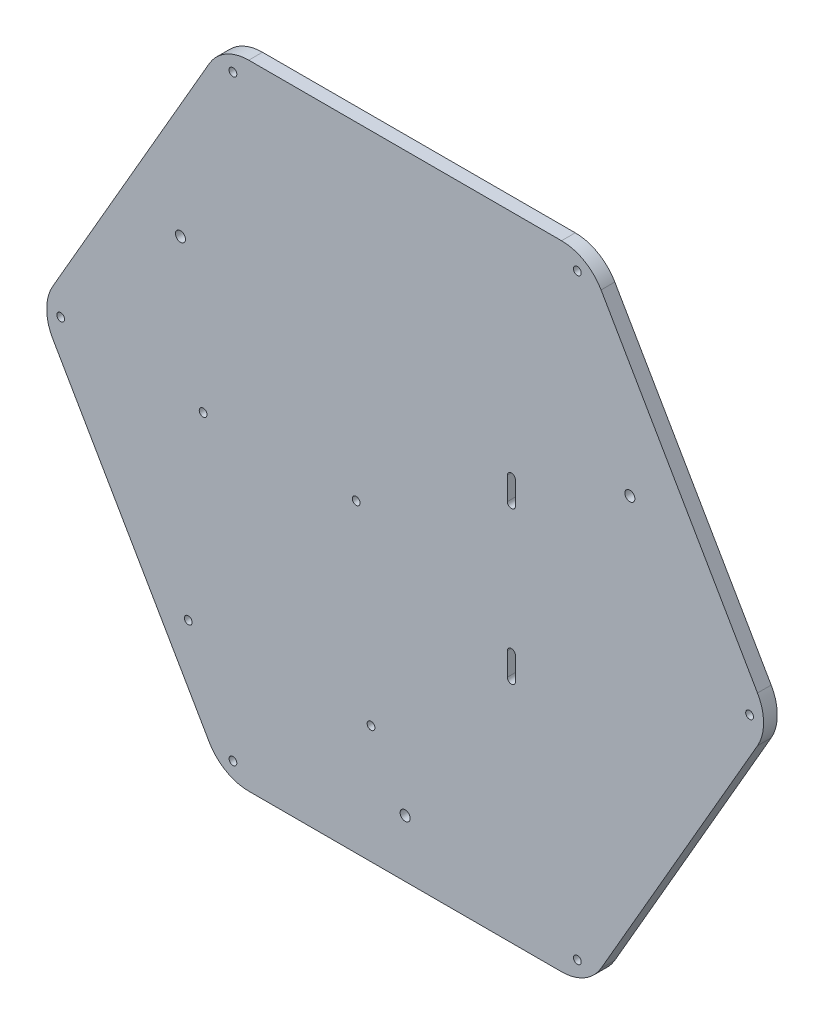
from build123d import *

# Parameters (mm, degrees)
BOSS_EXTRUDE1_DEPTH = 6
FILLET1_R           = 20
SKETCH9_R           = 1.7
CUT_EXTRUDE7_DEPTH  = 70
SKETCH10_R          = 1.7
CUT_EXTRUDE8_DEPTH  = 10
CUT_EXTRUDE9_DEPTH  = 10
SKETCH12_R          = 2.2
CUT_EXTRUDE10_DEPTH = 10


with BuildPart() as part:
    # Sketch1 → Boss-Extrude1 (new body)
    with BuildSketch(Plane.XY):
        Polygon((80, 138.564064606), (-80, 138.564064606), (-160, 0), (-80, -138.564064606), (80, -138.564064606), (160, 0), align=None)
    extrude(amount=BOSS_EXTRUDE1_DEPTH)

    # Fillet1
    fillet1_edges = [part.edges().sort_by_distance(p)[0] for p in [
        (160, 0, 3),
        (80, -138.564064606, 3),
        (-80, -138.564064606, 3),
        (-160, 0, 3),
        (-80, 138.564064606, 3),
        (80, 138.564064606, 3),
    ]]
    fillet(fillet1_edges, radius=FILLET1_R)

    # Sketch9 → Cut-Extrude7 (cut)
    with BuildSketch(Plane.XY.offset(6)):
        with Locations((-75.381197846, -130.564064606)):
            Circle(SKETCH9_R)
        with Locations((75.381197846, -130.564064606)):
            Circle(SKETCH9_R)
        with Locations((-75.381197846, 130.564064606)):
            Circle(SKETCH9_R)
        with Locations((-150.762395693, 0)):
            Circle(SKETCH9_R)
        with Locations((150.762395693, 0)):
            Circle(SKETCH9_R)
        with Locations((75.381197846, 130.564064606)):
            Circle(SKETCH9_R)
    extrude(amount=-CUT_EXTRUDE7_DEPTH, mode=Mode.SUBTRACT)

    # Sketch10 → Cut-Extrude8 (cut)
    with BuildSketch(Plane.XY.offset(6)):
        with Locations((-88.437426954, -5)):
            Circle(SKETCH10_R)
        with Locations((-21.437426954, -5)):
            Circle(SKETCH10_R)
        with Locations((-14.937426954, -87)):
            Circle(SKETCH10_R)
        with Locations((-94.937426954, -87)):
            Circle(SKETCH10_R)
    extrude(amount=-CUT_EXTRUDE8_DEPTH, mode=Mode.SUBTRACT)

    # Sketch11 → Cut-Extrude9 (cut)
    with BuildSketch(Plane.XY.offset(6)):
        with BuildLine():
            Line((48.25, 37.808388537), (48.25, 27.808388537))
            ThreePointArc((48.25, 27.808388537), (46.5, 26.058388537), (44.75, 27.808388537))
            Line((44.75, 27.808388537), (44.75, 37.808388537))
            ThreePointArc((44.75, 37.808388537), (46.5, 39.558388537), (48.25, 37.808388537))
        make_face()
        with BuildLine():
            Line((48.25, -38.75), (48.25, -28.75))
            ThreePointArc((48.25, -28.75), (46.5, -27), (44.75, -28.75))
            Line((44.75, -28.75), (44.75, -38.75))
            ThreePointArc((44.75, -38.75), (46.5, -40.5), (48.25, -38.75))
        make_face()
    extrude(amount=-CUT_EXTRUDE9_DEPTH, mode=Mode.SUBTRACT)

    # Sketch12 → Cut-Extrude10 (cut)
    with BuildSketch(Plane.XY.offset(6)):
        with Locations((0, -113.564064606)):
            Circle(SKETCH12_R)
        with Locations((-98.349364905, 56.782032303)):
            Circle(SKETCH12_R)
        with Locations((98.349364905, 56.782032303)):
            Circle(SKETCH12_R)
    extrude(amount=-CUT_EXTRUDE10_DEPTH, mode=Mode.SUBTRACT)


solid = part.part
